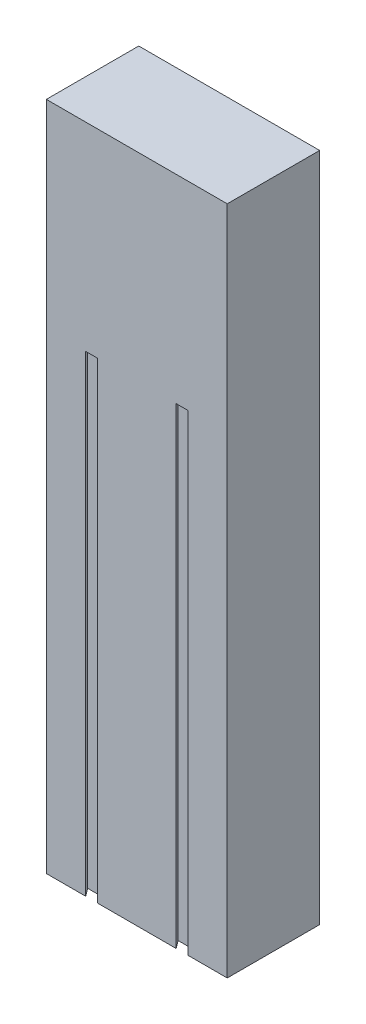
from build123d import *

# Parameters (mm, degrees)
P_IDAT_VYSUNUT_M2_DEPTH     = 16.5
SKICA2_W                    = 46
SKICA2_H                    = 170.5
SKICA2_W_2                  = 37
SKICA2_H_2                  = 161.5
P_IDAT_VYSUNUT_M4_DEPTH     = 2
SKICA3_W                    = 46
SKICA3_H                    = 170.5
SKICA3_W_2                  = 37
SKICA3_H_2                  = 33.5
P_IDAT_VYSUNUT_M5_DEPTH     = 3
SKICA4_W                    = 37
SKICA4_H                    = 33.5
P_IDAT_VYSUNUT_M6_DEPTH     = 2
SKICA9_W                    = 46
SKICA9_H                    = 170.5
SKICA9_W_2                  = 37
SKICA9_H_2                  = 161.5
P_IDAT_VYSUNUT_M9_DEPTH     = 2
SKICA10_R                   = 1.75
D_RY_NA_Z_PUSTN_MATKY_DEPTH = 5
ZAOBLIT1_R                  = 2.5
SKICA11_R                   = 5.75
KONEKTORY_DEPTH             = 4.5
DR_KA_K_TER_U_DEPTH         = 120


with BuildPart() as part:
    # Skica1 → Přidat vysunutím2 (new body)
    with BuildSketch(Plane.XY):
        Polygon((40, 157.5), (-6, 157.5), (-6, 0), (-6, -13), (40, -13), (40, 0), align=None)
        Polygon((-1.5, 0), (-1.5, 153), (35.5, 153), (35.5, 0), (35.5, -8.5), (-1.5, -8.5), align=None, mode=Mode.SUBTRACT)
    extrude(amount=-P_IDAT_VYSUNUT_M2_DEPTH)

    # Skica2 → Přidat vysunutím4 (add)
    with BuildSketch(Plane.XY):
        with Locations((17, 72.25)):
            Rectangle(SKICA2_W, SKICA2_H)
        with Locations((17, 72.25)):
            Rectangle(SKICA2_W_2, SKICA2_H_2, mode=Mode.SUBTRACT)
    extrude(amount=P_IDAT_VYSUNUT_M4_DEPTH)

    # Skica3 → Přidat vysunutím5 (add)
    with BuildSketch(Plane.XY.offset(2)):
        with Locations((17, 72.25)):
            Rectangle(SKICA3_W, SKICA3_H)
        with Locations((17, 136.25)):
            Rectangle(SKICA3_W_2, SKICA3_H_2, mode=Mode.SUBTRACT)
    extrude(amount=P_IDAT_VYSUNUT_M5_DEPTH)

    # Skica4 → Přidat vysunutím6 (add)
    with BuildSketch(Plane.XY.offset(5)):
        with Locations((17, 136.25)):
            Rectangle(SKICA4_W, SKICA4_H)
    extrude(amount=-P_IDAT_VYSUNUT_M6_DEPTH)

    # Skica9 → Přidat vysunutím9 (add)
    with BuildSketch(Plane(origin=(0, 0, -16.5), x_dir=(-1, 0, 0), z_dir=(0, 0, -1))):
        with Locations((-17, 72.25)):
            Rectangle(SKICA9_W, SKICA9_H)
        with Locations((-17, 72.25)):
            Rectangle(SKICA9_W_2, SKICA9_H_2, mode=Mode.SUBTRACT)
    extrude(amount=P_IDAT_VYSUNUT_M9_DEPTH)

    # Skica10 → Díry na zápustný matky (cut)
    with BuildSketch(Plane(origin=(0, 0, -18.5), x_dir=(-1, 0, 0), z_dir=(0, 0, -1))):
        with Locations((3.5, -10.5)):
            Circle(SKICA10_R)
        with Locations((-37.5, -10.5)):
            Circle(SKICA10_R)
        with Locations((-37.5, 30.5)):
            Circle(SKICA10_R)
        with Locations((-37.5, 71.5)):
            Circle(SKICA10_R)
        with Locations((-37.5, 112.5)):
            Circle(SKICA10_R)
        with Locations((-37.5, 153.5)):
            Circle(SKICA10_R)
        with Locations((3.5, 30.5)):
            Circle(SKICA10_R)
        with Locations((3.5, 71.5)):
            Circle(SKICA10_R)
        with Locations((3.5, 112.5)):
            Circle(SKICA10_R)
        with Locations((3.5, 153.5)):
            Circle(SKICA10_R)
    extrude(amount=-D_RY_NA_Z_PUSTN_MATKY_DEPTH, mode=Mode.SUBTRACT)

    # Zaoblit1
    zaoblit1_edges = [part.edges().sort_by_distance(p)[0] for p in [
        (-1.5, 153, -7.75),
        (35.5, 153, -7.75),
        (35.5, -8.5, -8.25),
        (-1.5, -8.5, -8.25),
    ]]
    fillet(zaoblit1_edges, radius=ZAOBLIT1_R)

    # Skica11 → konektory (cut)
    with BuildSketch(Plane.XZ.offset(13)):
        with Locations(Location((27, -6.5, 0), (0, 0, 270))):
            Circle(SKICA11_R)
        with Locations(Location((7, -6.5, 0), (0, 0, 180))):
            Circle(SKICA11_R)
    extrude(amount=-KONEKTORY_DEPTH, mode=Mode.SUBTRACT)

    # Skica13 → Drážka k terču (cut)
    with BuildSketch(Plane.XZ.offset(13)):
        Polygon((31.5, 3), (25.5, 3), (27, 5), (30, 5), align=None)
        Polygon((7, 5), (4, 5), (2.5, 3), (8.5, 3), align=None)
    extrude(amount=-DR_KA_K_TER_U_DEPTH, mode=Mode.SUBTRACT)


solid = part.part
